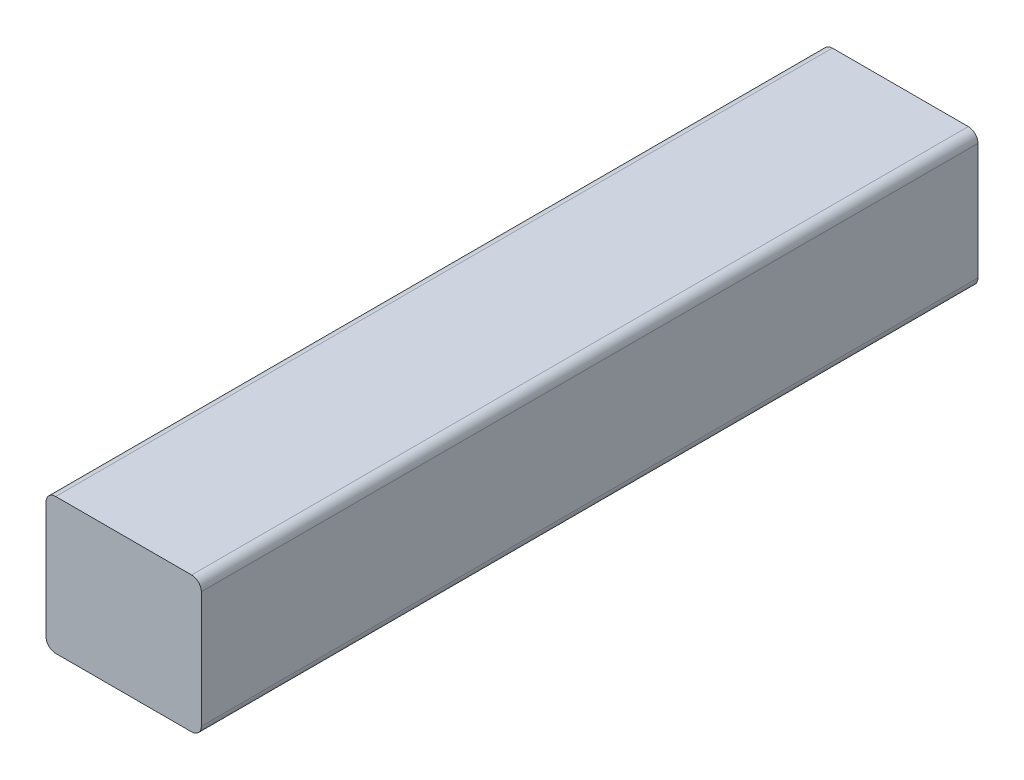
from build123d import *

# Parameters (mm, degrees)
SKETCH1_W           = 8
SKETCH1_H           = 7
BOSS_EXTRUDE1_DEPTH = 40
FILLET1_R           = 0.5


with BuildPart() as part:
    # Sketch1 → Boss-Extrude1 (new body)
    with BuildSketch(Plane.XY):
        Rectangle(SKETCH1_W, SKETCH1_H)
    extrude(amount=BOSS_EXTRUDE1_DEPTH)

    # Fillet1
    fillet1_edges = [part.edges().sort_by_distance(p)[0] for p in [
        (4, -3.5, 20),
        (-4, -3.5, 20),
        (-4, 3.5, 20),
        (4, 3.5, 20),
    ]]
    fillet(fillet1_edges, radius=FILLET1_R)


solid = part.part
